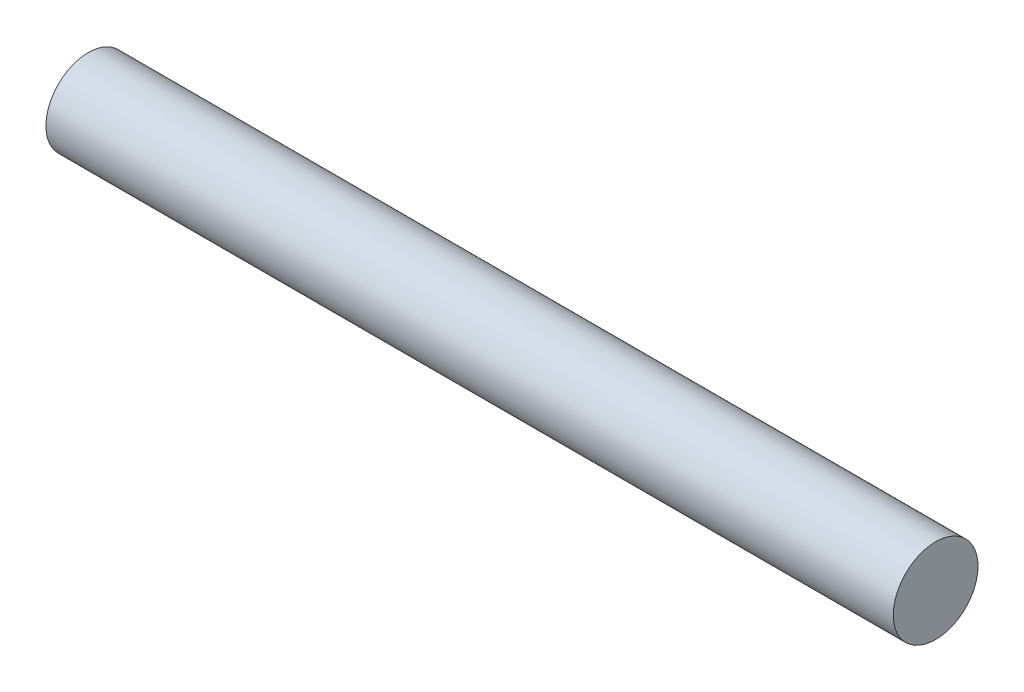
from build123d import *

# Parameters (mm, degrees)
SKETCH1_R           = 0.381
BOSS_EXTRUDE1_DEPTH = 7.62


with BuildPart() as part:
    # Sketch1 → Boss-Extrude1 (new body)
    with BuildSketch(Plane(origin=(0, 0, 0), x_dir=(0, 0, -1), z_dir=(1, 0, 0))):
        Circle(SKETCH1_R)
    extrude(amount=BOSS_EXTRUDE1_DEPTH)


solid = part.part
